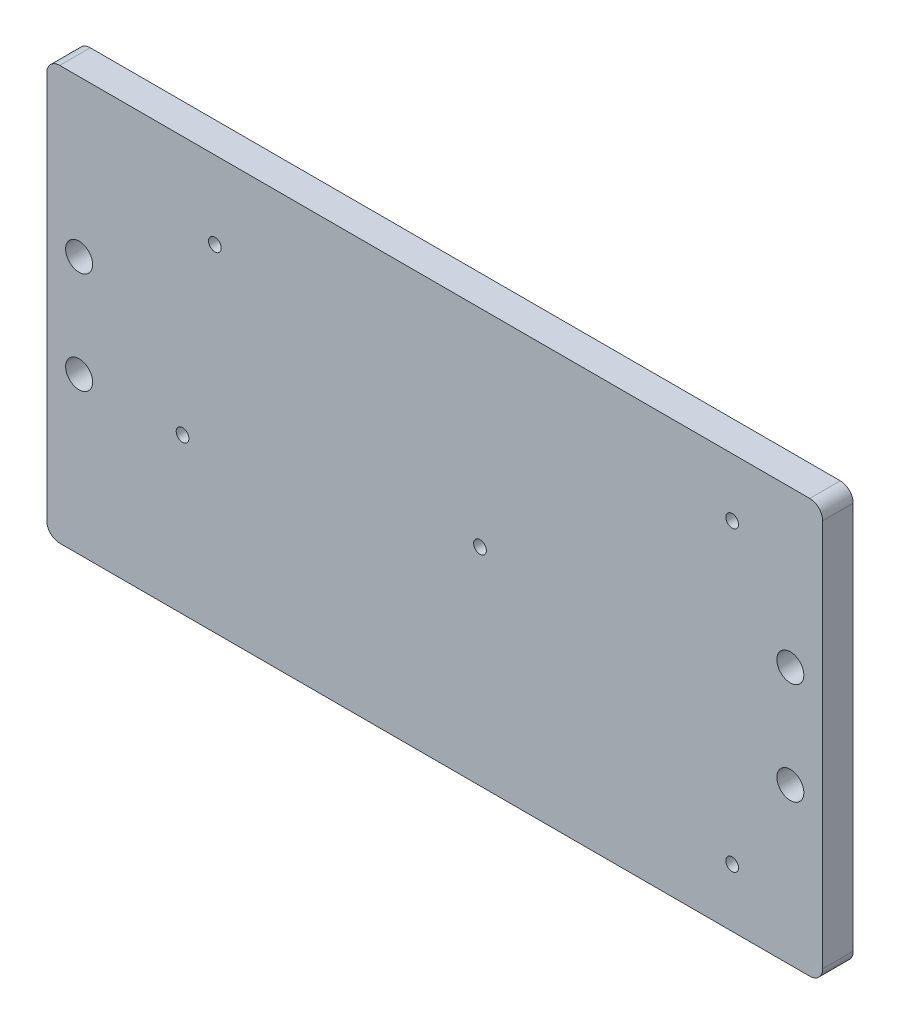
from build123d import *

# Parameters (mm, degrees)
BOSS_EXTRUDE1_DEPTH   = 6
M5_CLEARANCE_HOLE1_D  = 5.3
M3X0_5_TAPPED_HOLE1_D = 2.5


with BuildPart() as part:
    # Sketch1 → Boss-Extrude1 (new body)
    with BuildSketch(Plane(origin=(0, 0, -11.999999876), x_dir=(-1, 0, 0), z_dir=(0, 0, -1))):
        with BuildLine():
            Line((-525.4371, 434.7464), (-378.1171, 434.7464))
            ThreePointArc((-378.1171, 434.7464), (-376.321048776, 434.002451224), (-375.5771, 432.2064))
            Line((-375.5771, 432.2064), (-375.5771, 356.0064))
            ThreePointArc((-375.5771, 356.0064), (-376.321048776, 354.210348776), (-378.1171, 353.4664))
            Line((-378.1171, 353.4664), (-525.4371, 353.4664))
            ThreePointArc((-525.4371, 353.4664), (-527.233151224, 354.210348776), (-527.9771, 356.0064))
            Line((-527.9771, 356.0064), (-527.9771, 432.2064))
            ThreePointArc((-527.9771, 432.2064), (-527.233151224, 434.002451224), (-525.4371, 434.7464))
        make_face()
    extrude(amount=BOSS_EXTRUDE1_DEPTH)

    # M5 Clearance Hole1 (through all)
    with Locations(Plane(origin=(0, 0, -17.999999876), x_dir=(-1, 0, 0), z_dir=(0, 0, -1))):
        with Locations((-521.6271, 404.106399939), (-521.6271, 384.106400061), (-381.9271, 384.106400061), (-381.9271, 404.106399939)):
            Hole(M5_CLEARANCE_HOLE1_D / 2)

    # M3x0.5 Tapped Hole1 (through all)
    with Locations(Plane(origin=(0, 0, -17.999999876), x_dir=(-1, 0, 0), z_dir=(0, 0, -1))):
        with Locations((-510.1971, 423.3164), (-408.5971, 419.5064), (-460.6671, 394.1064), (-402.2471, 383.9464), (-510.1971, 364.8964)):
            Hole(M3X0_5_TAPPED_HOLE1_D / 2)


solid = part.part
